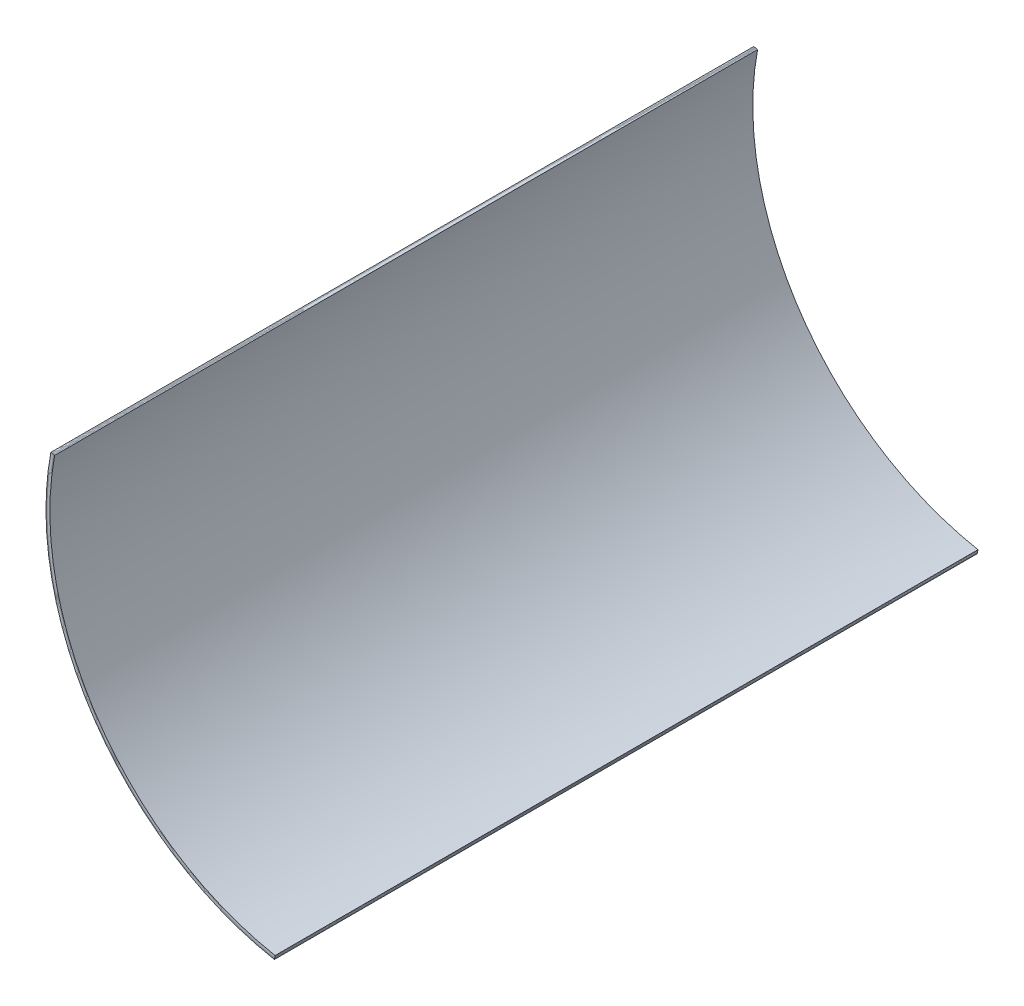
from build123d import *

# Parameters (mm, degrees)
EXTRUDE_THIN1_DEPTH   = 607.06
EXTRUDE_THIN1_2_DEPTH = 607.06


with BuildPart() as part:
    # Sketch1 → Extrude-Thin1 (new body)
    with BuildSketch(Plane.XY):
        with BuildLine():
            ThreePointArc((-44.738916424, -237.11625705), (-199.301704476, -136.031322103), (-237.11625705, 44.738916424))
            Line((-237.11625705, 44.738916424), (-234.620296449, 44.267980462))
            ThreePointArc((-234.620296449, 44.267980462), (-197.203791797, -134.599413449), (-44.267980462, -234.620296449))
            Line((-44.267980462, -234.620296449), (-44.738916424, -237.11625705))
        make_face()
    extrude(amount=EXTRUDE_THIN1_DEPTH)


with BuildPart() as body_2:
    # Sketch1 → Extrude-Thin1 2 (new body)
    with BuildSketch(Plane.XY):
        with BuildLine():
            ThreePointArc((-44.889615932, -237.914964442), (-199.973036533, -136.489532872), (-237.914964442, 44.889615932))
            Line((-237.914964442, 44.889615932), (-235.419003841, 44.41867997))
            ThreePointArc((-235.419003841, 44.41867997), (-197.875123854, -135.057624218), (-44.41867997, -235.419003841))
            Line((-44.41867997, -235.419003841), (-44.889615932, -237.914964442))
        make_face()
    extrude(amount=EXTRUDE_THIN1_2_DEPTH)


solid = Compound([part.part, body_2.part])
